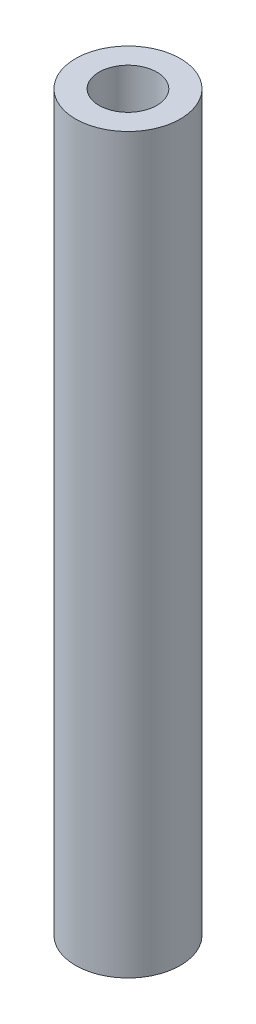
from build123d import *

# Parameters (mm, degrees)
SKETCH1_R           = 3.175
SKETCH1_R_2         = 1.7526
BOSS_EXTRUDE1_DEPTH = 44.45


with BuildPart() as part:
    # Sketch1 → Boss-Extrude1 (new body)
    with BuildSketch(Plane(origin=(0, 0, 0), x_dir=(1, 0, 0), z_dir=(0, 1, 0))):
        with Locations(Location((0, 0, 0), (0, 0, 270))):
            Circle(SKETCH1_R)
        with Locations(Location((0, 0, 0), (0, 0, 270))):
            Circle(SKETCH1_R_2, mode=Mode.SUBTRACT)
    extrude(amount=BOSS_EXTRUDE1_DEPTH)


solid = part.part
